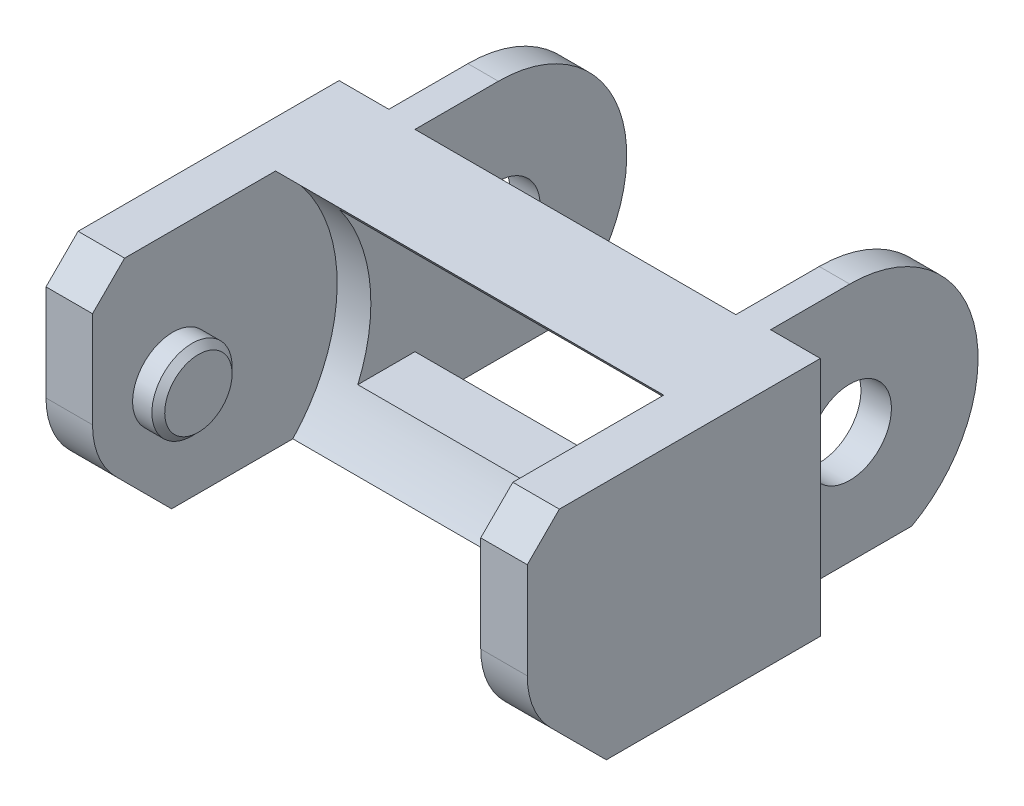
from build123d import *

# Parameters (mm, degrees)
SKETCH_1_W               = 30
SKETCH_1_H               = 15
EXTRUDE_1_DEPTH          = 18
CUT_EXTRUDE_1_REACH      = 28.843
SKETCH_2_W               = 20
SKETCH_2_H               = 10
CUT_EXTRUDE_2_REACH      = 29.668
SKETCH_3_W               = 20
SKETCH_3_H               = 12
CUT_EXTRUDE_5_DEPTH      = 22.1
CUT_EXTRUDE_5_DEPTH_BACK = 2.1
SKETCH_4_W               = 5
SKETCH_4_H               = 6
SKETCH_5_R               = 2.5
EXTRUDE_2_DEPTH          = 1.6
EXTRUDE_START            = 1.6
SKETCH_6_R               = 2.5
EXTRUDE_3_DEPTH          = 1.6
CHAMFER_1_SIZE           = 0.4
CUT_EXTRUDE_6_DEPTH      = 35.020684023
CUT_EXTRUDE_6_DEPTH_BACK = 35.020684023
CUT_EXTRUDE_7_DEPTH      = 35.020684023
CUT_EXTRUDE_7_DEPTH_BACK = 35.020684023
EXTRUDE_4_DEPTH          = 20
SKETCH_10_R              = 2.6
CUT_EXTRUDE_8_DEPTH      = 35.965796737
CUT_EXTRUDE_9_DEPTH      = 35.965796737
CUT_EXTRUDE_9_DEPTH_BACK = 35.965796737
SKETCH_12_W              = 1.696031958
SKETCH_12_H              = 15
CHAMFER_2_SIZE           = 2
SKETCH_17_W              = 3.1
SKETCH_17_H              = 15
EXTRUDE_8_DEPTH          = 0.27


with BuildPart() as part:
    # 草圖1 → 填料-伸長1 (new body)
    with BuildSketch(Plane.XY):
        with Locations((2.249045701, -2.44972067)):
            Rectangle(SKETCH_1_W, SKETCH_1_H)
    extrude(amount=EXTRUDE_1_DEPTH)

    # 草圖2 → 除料-伸長1 (cut, up to next)
    with BuildSketch(Plane.XY.offset(18), mode=Mode.PRIVATE) as cut_extrude_1_sk1:
        with Locations((2.249045701, -1.94972067)):
            Rectangle(SKETCH_2_W, SKETCH_2_H)
    cut_extrude_1_tool1 = extrude(cut_extrude_1_sk1.sketch, amount=-CUT_EXTRUDE_1_REACH, mode=Mode.PRIVATE) & part.part
    add(cut_extrude_1_tool1.solids().sort_by_distance((2.249046, -1.949721, 18))[0], mode=Mode.SUBTRACT)

    # 草圖3 → 除料-伸長2 (cut, up to next)
    with BuildSketch(Plane(origin=(0, -6.94972067, 0), x_dir=(1, 0, 0), z_dir=(0, 1, 0)), mode=Mode.PRIVATE) as cut_extrude_2_sk1:
        with Locations((2.249045701, -12)):
            Rectangle(SKETCH_3_W, SKETCH_3_H)
    cut_extrude_2_tool1 = extrude(cut_extrude_2_sk1.sketch, amount=-CUT_EXTRUDE_2_REACH, mode=Mode.PRIVATE) & part.part
    add(cut_extrude_2_tool1.solids().sort_by_distance((2.249046, -6.949721, 12))[0], mode=Mode.SUBTRACT)

    # 草圖4 → 除料-伸長5 (cut, two sides: drawn at the far end of the back side and taken through both)
    with BuildSketch(Plane(origin=(-7.750954299, 0, 0), x_dir=(0, 0, -1), z_dir=(1, 0, 0)).offset(-CUT_EXTRUDE_5_DEPTH_BACK)):
        with Locations((-15.5, 0.05027933)):
            Rectangle(SKETCH_4_W, SKETCH_4_H)
        with BuildLine():
            Line((-13, 3.05027933), (-13, -2.94972067))
            Line((-13, -2.94972067), (-18, -2.94972067))
            Line((-18, -2.94972067), (-18, -9.94972067))
            Line((-18, -9.94972067), (-6, -9.94972067))
            Line((-6, -9.94972067), (-6, -6.94972067))
            Line((-6, -6.94972067), (-3.562706956, -6.94972067))
            ThreePointArc((-3.562706956, -6.94972067), (-2.955231369, -4.990584005), (-2.75, -2.94972067))
            ThreePointArc((-2.75, -2.94972067), (-3.246950555, 0.203139384), (-4.689614931, 3.05027933))
            Line((-4.689614931, 3.05027933), (-13, 3.05027933))
        make_face()
        with BuildLine():
            ThreePointArc((-18, 5.998044414), (-15.583399687, 6.969379392), (-13, 7.30027933))
            Line((-13, 7.30027933), (-13, 7.89449882))
            Line((-13, 7.89449882), (-18, 7.89449882))
            Line((-18, 7.89449882), (-18, 5.998044414))
        make_face()
        with BuildLine():
            Line((-13, 7.30027933), (-13, 3.05027933))
            Line((-13, 3.05027933), (-4.689614931, 3.05027933))
            ThreePointArc((-4.689614931, 3.05027933), (-8.332961324, 6.176135454), (-13, 7.30027933))
        make_face()
        with BuildLine():
            Line((-18, 3.05027933), (-13, 3.05027933))
            Line((-13, 3.05027933), (-13, 7.30027933))
            ThreePointArc((-13, 7.30027933), (-15.583399687, 6.969379392), (-18, 5.998044414))
            Line((-18, 5.998044414), (-18, 3.05027933))
        make_face()
        with BuildLine():
            Line((-18, -9.94972067), (-18, -2.94972067))
            Line((-18, -2.94972067), (-18, 3.05027933))
            Line((-18, 3.05027933), (-18, 5.998044414))
            ThreePointArc((-18, 5.998044414), (-19.843504041, -10.580510436), (-3.562706956, -6.94972067))
            Line((-3.562706956, -6.94972067), (-6, -6.94972067))
            Line((-6, -6.94972067), (-6, -9.94972067))
            Line((-6, -9.94972067), (-18, -9.94972067))
        make_face()
    extrude(amount=CUT_EXTRUDE_5_DEPTH + CUT_EXTRUDE_5_DEPTH_BACK, mode=Mode.SUBTRACT)

    # 草圖5 → 填料-伸長2 (add)
    with BuildSketch(Plane.ZY.offset(-14.349045701)):
        with Locations(Location((13, -2.94972067, 0), (0, 0, 90))):
            Circle(SKETCH_5_R)
    extrude(amount=EXTRUDE_2_DEPTH)

    # 草圖6 → 填料-伸長3 (add)
    with BuildSketch(Plane(origin=(-9.850954299, 0, 0), x_dir=(0, 0, -1), z_dir=(1, 0, 0)).offset(EXTRUDE_START)):
        with Locations(Location((-13, -2.94972067, 0), (0, 0, 90))):
            Circle(SKETCH_6_R)
    extrude(amount=-EXTRUDE_3_DEPTH)

    # 導角1
    chamfer_1_edges = [part.edges().sort_by_distance(p)[0] for p in [
        (12.749045701, -5.44972067, 13),
        (-8.250954299, -5.44972067, 13),
    ]]
    chamfer(chamfer_1_edges, length=CHAMFER_1_SIZE)

    # 草圖7 → 除料-伸長6 (cut, two sides: drawn at the far end of the back side and taken through both)
    with BuildSketch(Plane(origin=(-9.850954299, 0, 0), x_dir=(0, 0, -1), z_dir=(1, 0, 0)).offset(-CUT_EXTRUDE_6_DEPTH_BACK)):
        Polygon((-18, -9.94972067), (-13.071067812, -9.94972067), (-18, -5.020788482), align=None)
    extrude(amount=CUT_EXTRUDE_6_DEPTH + CUT_EXTRUDE_6_DEPTH_BACK, mode=Mode.SUBTRACT)

    # 草圖8 → 除料-伸長7 (cut, two sides: drawn at the far end of the back side and taken through both)
    with BuildSketch(Plane(origin=(-9.850954299, 0, 0), x_dir=(0, 0, -1), z_dir=(1, 0, 0)).offset(-CUT_EXTRUDE_7_DEPTH_BACK)):
        with BuildLine():
            Line((-18, -2.94972067), (-18, -5.020788482))
            Line((-18, -5.020788482), (-16.535533871, -6.485254612))
            ThreePointArc((-16.535533871, -6.485254612), (-17.619397653, -4.863137855), (-18, -2.94972067))
        make_face()
    extrude(amount=CUT_EXTRUDE_7_DEPTH + CUT_EXTRUDE_7_DEPTH_BACK, mode=Mode.SUBTRACT)

    # 草圖9 → 填料-伸長4 (add)
    with BuildSketch(Plane(origin=(0, 0, 0), x_dir=(-1, 0, 0), z_dir=(0, 0, -1))):
        Polygon((9.650954299, 5.05027933), (7.750954299, 5.05027933), (7.750954299, 3.05027933), (7.750954299, -6.94972067), (7.750954299, -9.94972067), (9.650954299, -9.94972067), align=None)
        Polygon((-12.249045701, 3.05027933), (-12.249045701, 5.05027933), (-14.149045701, 5.05027933), (-14.149045701, -9.94972067), (-12.249045701, -9.94972067), (-12.249045701, -6.94972067), align=None)
    extrude(amount=EXTRUDE_4_DEPTH)

    # 草圖10 → 除料-伸長8 (cut, through all)
    with BuildSketch(Plane(origin=(14.149045701, 0, 0), x_dir=(0, 0, -1), z_dir=(1, 0, 0))):
        with Locations((5.2, -2.94972067)):
            Circle(SKETCH_10_R)
    extrude(amount=-CUT_EXTRUDE_8_DEPTH, mode=Mode.SUBTRACT)

    # 草圖12 → 除料-伸長9 (cut, two sides: drawn at the far end of the back side and taken through both)
    with BuildSketch(Plane(origin=(14.149045701, 0, 0), x_dir=(0, 0, -1), z_dir=(1, 0, 0)).offset(-CUT_EXTRUDE_9_DEPTH_BACK)):
        with BuildLine():
            Line((18.303968042, 5.05027933), (5.2, 5.05027933))
            ThreePointArc((5.2, 5.05027933), (10.856854249, 2.707133579), (13.2, -2.94972067))
            ThreePointArc((13.2, -2.94972067), (12.091439137, -7.012732683), (9.072983346, -9.94972067))
            Line((9.072983346, -9.94972067), (18.303968042, -9.94972067))
            Line((18.303968042, -9.94972067), (18.303968042, 5.05027933))
        make_face()
        with Locations((19.151984021, -2.44972067)):
            Rectangle(SKETCH_12_W, SKETCH_12_H)
    extrude(amount=CUT_EXTRUDE_9_DEPTH + CUT_EXTRUDE_9_DEPTH_BACK, mode=Mode.SUBTRACT)

    # 導角2
    chamfer_2_edges = [part.edges().sort_by_distance(p)[0] for p in [
        (15.799045701, 5.05027933, 18),
        (-11.300954299, 5.05027933, 18),
    ]]
    chamfer(chamfer_2_edges, length=CHAMFER_2_SIZE)

    # 草圖17 → 填料-伸長8 (add)
    with BuildSketch(Plane(origin=(0, 0, 0), x_dir=(-1, 0, 0), z_dir=(0, 0, -1))):
        with Locations((-15.699045701, -2.44972067)):
            Rectangle(SKETCH_17_W, SKETCH_17_H)
        with Locations((11.200954299, -2.44972067)):
            Rectangle(SKETCH_17_W, SKETCH_17_H)
    extrude(amount=EXTRUDE_8_DEPTH)


solid = part.part
